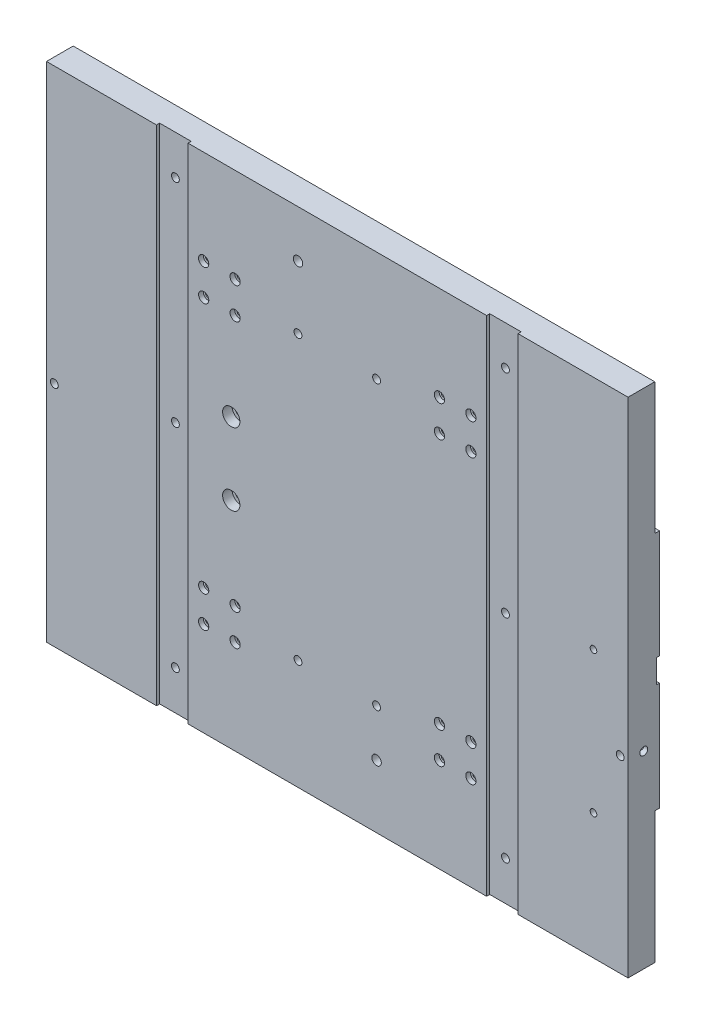
from build123d import *

# Parameters (mm, degrees)
SKETCH_1_W                     = 370
SKETCH_1_H                     = 320
EXTRUDE_1_DEPTH                = 20
SKETCH_2_W                     = 3
SKETCH_2_H                     = 83.6
CUT_EXTRUDE_1_DEPTH            = 490.591666596
SKETCH_3_W                     = 90
SKETCH_3_H                     = 2
CUT_EXTRUDE_2_DEPTH            = 490.591666596
SKETCH_4_W                     = 20
SKETCH_4_H                     = 2
CUT_EXTRUDE_3_DEPTH            = 490.591666596
SKETCH_6_W                     = 90
SKETCH_6_H                     = 320
EXTRUDE_2_DEPTH                = 2
SKETCH_5_W                     = 2
SKETCH_5_H                     = 15
CUT_EXTRUDE_4_DEPTH            = 490.591666596
SKETCH_7_R                     = 2.5
CUT_EXTRUDE_5_DEPTH            = 15
HOLE_WIZARD_M6_1_D             = 5
HOLE_WIZARD_M6_1_DEPTH         = 15
HOLE_WIZARD_M6_1_TIP           = 1.502151548
SKETCH_10_R                    = 2.5
CUT_EXTRUDE_6_DEPTH            = 15
HOLE_WIZARD_M6_2_D             = 5
HOLE_WIZARD_M6_2_DEPTH         = 15
HOLE_WIZARD_M6_2_TIP           = 1.502151548
SKETCH_13_R                    = 3
CUT_EXTRUDE_7_DEPTH            = 490.591666596
HOLE_WIZARD_M6_3_D             = 5
HOLE_WIZARD_M6_3_DEPTH         = 15
HOLE_WIZARD_M6_3_TIP           = 1.502151548
HOLE_WIZARD_M3_1_D             = 3.6
HOLE_WIZARD_M3_1_CBORE_D       = 6.5
HOLE_WIZARD_M3_1_CBORE_DEPTH   = 3
HOLE_WIZARD_M3_2_D             = 3.6
HOLE_WIZARD_M3_2_CBORE_D       = 6.5
HOLE_WIZARD_M3_2_CBORE_DEPTH   = 3
HOLE_WIZARD_M5_1_D             = 4.2
HOLE_WIZARD_M5_1_DEPTH         = 12.4
HOLE_WIZARD_M5_1_TIP           = 1.2618073
HOLE_WIZARD_M4_2_D             = 3.3
HOLE_WIZARD_M4_2_DEPTH         = 10.1
HOLE_WIZARD_M4_2_TIP           = 0.991420021
HOLE_WIZARD_M4_3_D             = 3.3
HOLE_WIZARD_M4_3_DEPTH         = 10.1
HOLE_WIZARD_M4_3_TIP           = 0.991420021
HOLE_WIZARD_M5_2_D             = 4.2
HOLE_WIZARD_M5_2_DEPTH         = 12.4
HOLE_WIZARD_M5_2_TIP           = 1.2618073
SKETCH_30_W                    = 15.1
SKETCH_30_H                    = 3
CUT_EXTRUDE_8_DEPTH            = 440.528110591
HOLE_WIZARD_M6_1_2_D           = 6.6
HOLE_WIZARD_M6_1_2_CBORE_D     = 11
HOLE_WIZARD_M6_1_2_CBORE_DEPTH = 6


with BuildPart() as part:
    # 草图1 → 凸台-拉伸1 (new body)
    with BuildSketch(Plane.XY):
        with Locations((185, 160)):
            Rectangle(SKETCH_1_W, SKETCH_1_H)
    extrude(amount=EXTRUDE_1_DEPTH)

    # 草图2 → 切除-拉伸1 (cut, through all)
    with BuildSketch(Plane(origin=(370, 0, 0), x_dir=(0, 0, -1), z_dir=(1, 0, 0))):
        with Locations((-1.5, 41.8)):
            Rectangle(SKETCH_2_W, SKETCH_2_H)
        with Locations((-1.5, 278.2)):
            Rectangle(SKETCH_2_W, SKETCH_2_H)
    extrude(amount=-CUT_EXTRUDE_1_DEPTH, mode=Mode.SUBTRACT)

    # 草图3 → 切除-拉伸2 (cut, through all)
    with BuildSketch(Plane.XZ):
        with Locations((185, 19)):
            Rectangle(SKETCH_3_W, SKETCH_3_H)
    extrude(amount=-CUT_EXTRUDE_2_DEPTH, mode=Mode.SUBTRACT)

    # 草图4 → 切除-拉伸3 (cut, through all)
    with BuildSketch(Plane.XZ):
        with Locations((80, 19)):
            Rectangle(SKETCH_4_W, SKETCH_4_H)
        with Locations((290, 19)):
            Rectangle(SKETCH_4_W, SKETCH_4_H)
    extrude(amount=-CUT_EXTRUDE_3_DEPTH, mode=Mode.SUBTRACT)

    # 草图6 → 凸台-拉伸2 (add)
    with BuildSketch(Plane.XY.offset(18)):
        with Locations((185, 160)):
            Rectangle(SKETCH_6_W, SKETCH_6_H)
    extrude(amount=EXTRUDE_2_DEPTH)

    # 草图5 → 切除-拉伸4 (cut, through all)
    with BuildSketch(Plane(origin=(370, 0, 0), x_dir=(0, 0, -1), z_dir=(1, 0, 0))):
        with Locations((-1, 160)):
            Rectangle(SKETCH_5_W, SKETCH_5_H)
    extrude(amount=-CUT_EXTRUDE_4_DEPTH, mode=Mode.SUBTRACT)

    # 草图7 → 切除-拉伸5 (cut)
    with BuildSketch(Plane.ZY):
        with Locations((10, 145)):
            Circle(SKETCH_7_R)
    extrude(amount=-CUT_EXTRUDE_5_DEPTH, mode=Mode.SUBTRACT)

    # Hole Wizard M6 _1
    with Locations(Plane.XY.offset(20)):
        with Locations((5, 145)):
            Hole(HOLE_WIZARD_M6_1_D / 2, depth=HOLE_WIZARD_M6_1_DEPTH)
            with Locations((0, 0, -(HOLE_WIZARD_M6_1_DEPTH + HOLE_WIZARD_M6_1_TIP / 2))):  # 118° drill point
                Cone(0, HOLE_WIZARD_M6_1_D / 2, HOLE_WIZARD_M6_1_TIP, mode=Mode.SUBTRACT)

    # 草图10 → 切除-拉伸6 (cut)
    with BuildSketch(Plane(origin=(370, 0, 0), x_dir=(0, 0, -1), z_dir=(1, 0, 0))):
        with Locations((-10, 120)):
            Circle(SKETCH_10_R)
    extrude(amount=-CUT_EXTRUDE_6_DEPTH, mode=Mode.SUBTRACT)

    # M6 螺纹孔2
    with Locations(Plane.XY.offset(20)):
        with Locations((365, 120)):
            Hole(HOLE_WIZARD_M6_2_D / 2, depth=HOLE_WIZARD_M6_2_DEPTH)
            with Locations((0, 0, -(HOLE_WIZARD_M6_2_DEPTH + HOLE_WIZARD_M6_2_TIP / 2))):  # 118° drill point
                Cone(0, HOLE_WIZARD_M6_2_D / 2, HOLE_WIZARD_M6_2_TIP, mode=Mode.SUBTRACT)

    # 草图13 → 切除-拉伸7 (cut, through all)
    with BuildSketch(Plane.XY.offset(20)):
        with Locations((210, 40)):
            Circle(SKETCH_13_R)
        with Locations((160, 290)):
            Circle(SKETCH_13_R)
    extrude(amount=-CUT_EXTRUDE_7_DEPTH, mode=Mode.SUBTRACT)

    # M6 螺纹孔3
    with Locations(Plane.XY.offset(20)):
        with Locations((160, 70), (210, 70), (160, 250), (210, 250), (290, 25), (290, 160), (290, 295), (80, 295), (80, 160), (80, 25)):
            Hole(HOLE_WIZARD_M6_3_D / 2, depth=HOLE_WIZARD_M6_3_DEPTH)
            with Locations((0, 0, -(HOLE_WIZARD_M6_3_DEPTH + HOLE_WIZARD_M6_3_TIP / 2))):  # 118° drill point
                Cone(0, HOLE_WIZARD_M6_3_D / 2, HOLE_WIZARD_M6_3_TIP, mode=Mode.SUBTRACT)

    # M3 六角凹头螺钉的柱形沉头孔1 (through all)
    with Locations(Plane.XY.offset(20)):
        with Locations((270, 80), (250, 60), (250, 80), (270, 60), (120, 60), (100, 60), (100, 80), (120, 80)):
            CounterBoreHole(HOLE_WIZARD_M3_1_D / 2, HOLE_WIZARD_M3_1_CBORE_D / 2, HOLE_WIZARD_M3_1_CBORE_DEPTH)

    # M3 六角凹头螺钉的柱形沉头孔2 (through all)
    with Locations(Plane.XY.offset(20)):
        with Locations((100, 260), (270, 260), (250, 260), (250, 240), (270, 240), (120, 260), (100, 240), (120, 240)):
            CounterBoreHole(HOLE_WIZARD_M3_2_D / 2, HOLE_WIZARD_M3_2_CBORE_D / 2, HOLE_WIZARD_M3_2_CBORE_DEPTH)

    # M5 螺纹孔1
    with Locations(Plane(origin=(0, 0, 2), x_dir=(-1, 0, 0), z_dir=(0, 0, -1))):
        with Locations((-264, 160), (-183, 160), (-21, 160), (-102, 160)):
            Hole(HOLE_WIZARD_M5_1_D / 2, depth=HOLE_WIZARD_M5_1_DEPTH)
            with Locations((0, 0, -(HOLE_WIZARD_M5_1_DEPTH + HOLE_WIZARD_M5_1_TIP / 2))):  # 118° drill point
                Cone(0, HOLE_WIZARD_M5_1_D / 2, HOLE_WIZARD_M5_1_TIP, mode=Mode.SUBTRACT)

    # M4 螺纹孔2
    with Locations(Plane(origin=(0, 0, 0), x_dir=(-1, 0, 0), z_dir=(0, 0, -1))):
        with Locations((-117, 220.5), (-127, 220.5), (-244, 220.5), (-254, 220.5)):
            Hole(HOLE_WIZARD_M4_2_D / 2, depth=HOLE_WIZARD_M4_2_DEPTH)
            with Locations((0, 0, -(HOLE_WIZARD_M4_2_DEPTH + HOLE_WIZARD_M4_2_TIP / 2))):  # 118° drill point
                Cone(0, HOLE_WIZARD_M4_2_D / 2, HOLE_WIZARD_M4_2_TIP, mode=Mode.SUBTRACT)

    # M4 螺纹孔3
    with Locations(Plane(origin=(0, 0, 3), x_dir=(-1, 0, 0), z_dir=(0, 0, -1))):
        with Locations((-253, 40.5), (-243, 40.5), (-128, 40.5), (-118, 40.5)):
            Hole(HOLE_WIZARD_M4_3_D / 2, depth=HOLE_WIZARD_M4_3_DEPTH)
            with Locations((0, 0, -(HOLE_WIZARD_M4_3_DEPTH + HOLE_WIZARD_M4_3_TIP / 2))):  # 118° drill point
                Cone(0, HOLE_WIZARD_M4_3_D / 2, HOLE_WIZARD_M4_3_TIP, mode=Mode.SUBTRACT)

    # M5 螺纹孔2
    with Locations(Plane.XY.offset(20)):
        with Locations((348, 80), (348, 170)):
            Hole(HOLE_WIZARD_M5_2_D / 2, depth=HOLE_WIZARD_M5_2_DEPTH)
            with Locations((0, 0, -(HOLE_WIZARD_M5_2_DEPTH + HOLE_WIZARD_M5_2_TIP / 2))):  # 118° drill point
                Cone(0, HOLE_WIZARD_M5_2_D / 2, HOLE_WIZARD_M5_2_TIP, mode=Mode.SUBTRACT)

    # 草图30 → 切除-拉伸8 (cut, through all)
    with BuildSketch(Plane.XZ.offset(-83.6)):
        with Locations((117.55, 1.5)):
            Rectangle(SKETCH_30_W, SKETCH_30_H)
    extrude(amount=-CUT_EXTRUDE_8_DEPTH, mode=Mode.SUBTRACT)

    # Hole Wizard M6 _1 2 (through all)
    with Locations(Plane.XY.offset(20)):
        with Locations((117.55, 137), (117.55, 183)):
            CounterBoreHole(HOLE_WIZARD_M6_1_2_D / 2, HOLE_WIZARD_M6_1_2_CBORE_D / 2, HOLE_WIZARD_M6_1_2_CBORE_DEPTH)


solid = part.part
